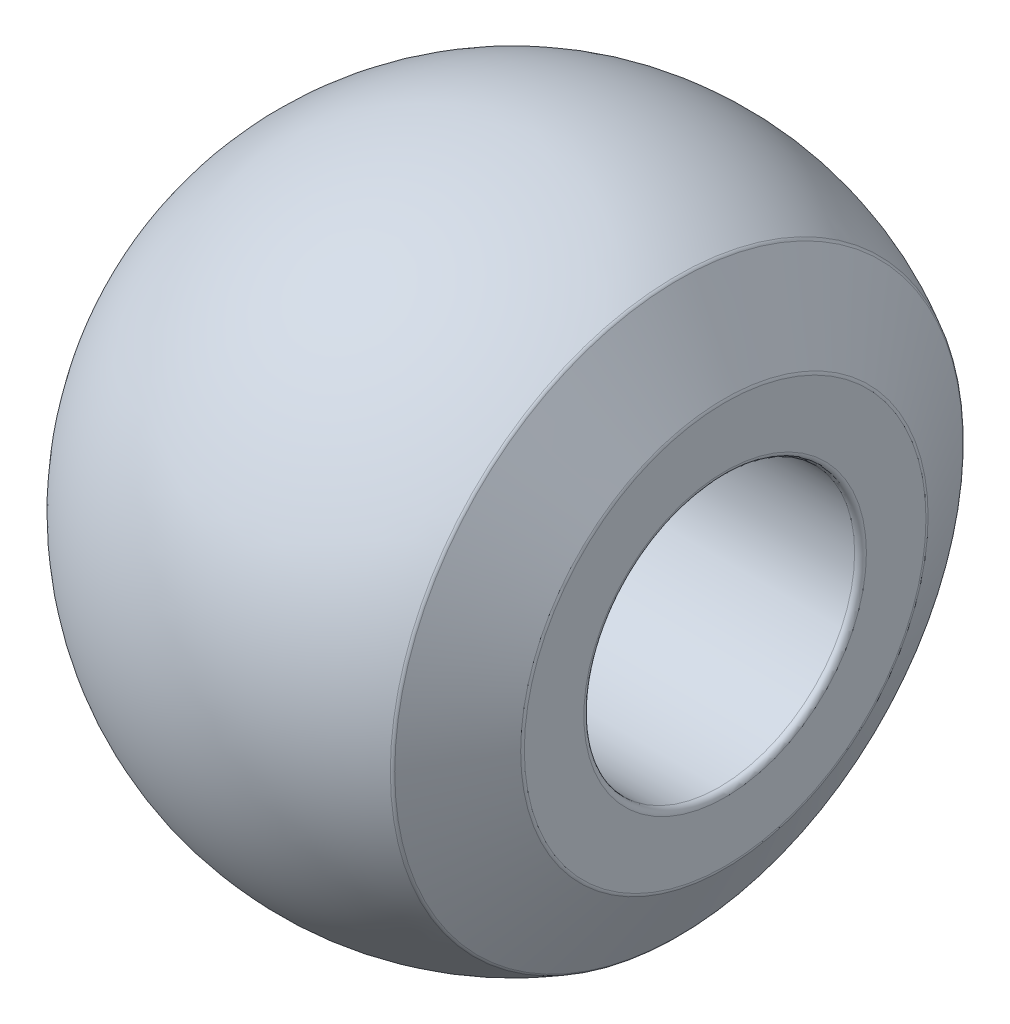
from build123d import *

# Parameters (mm, degrees)
SKETCH3_R          = 13.805
CUT_EXTRUDE1_DEPTH = 10
SKETCH4_R          = 5.75
CUT_EXTRUDE2_DEPTH = 11
FILLET1_R          = 0.25


with BuildPart() as part:
    # Sketch1 → Revolve1 (revolve)
    with BuildSketch(Plane(origin=(0, 0, 0), x_dir=(1, 0, 0), z_dir=(0, 1, 0))):
        with BuildLine():
            Line((0, 14), (0, -14))
            ThreePointArc((0, -14), (-14, 0), (0, 14))
        make_face()
    revolve(axis=Axis((0, 0, -14), (0, 0, 1)))

    # Sketch3 → Cut-Extrude1 (cut)
    with BuildSketch(Plane(origin=(9, 0, 0), x_dir=(0, 0, -1), z_dir=(1, 0, 0))):
        Circle(SKETCH3_R)
    extrude(amount=CUT_EXTRUDE1_DEPTH, mode=Mode.SUBTRACT)

    # Sketch4 → Cut-Extrude2 (cut)
    with BuildSketch(Plane(origin=(9, 0, 0), x_dir=(0, 0, -1), z_dir=(1, 0, 0))):
        Circle(SKETCH4_R)
    extrude(amount=-CUT_EXTRUDE2_DEPTH, mode=Mode.SUBTRACT)

    # Sketch6 → Cut-Revolve1 (revolve, cut)
    with BuildSketch(Plane(origin=(0, 0, 0), x_dir=(1, 0, 0), z_dir=(0, 1, 0))):
        Polygon((7, -12.124355653), (9.62, -7.5), (9.62, -12.124355653), align=None)
    revolve(axis=Axis((0, 0, 0), (1, 0, 0)), mode=Mode.SUBTRACT)

    # Fillet1
    fillet1_edges = [part.edges().sort_by_distance(p)[0] for p in [
        (9, 0, 5.75),
        (9, 0, -8.59431317),
        (7, 0, -12.124355653),
    ]]
    fillet(fillet1_edges, radius=FILLET1_R)


solid = part.part
